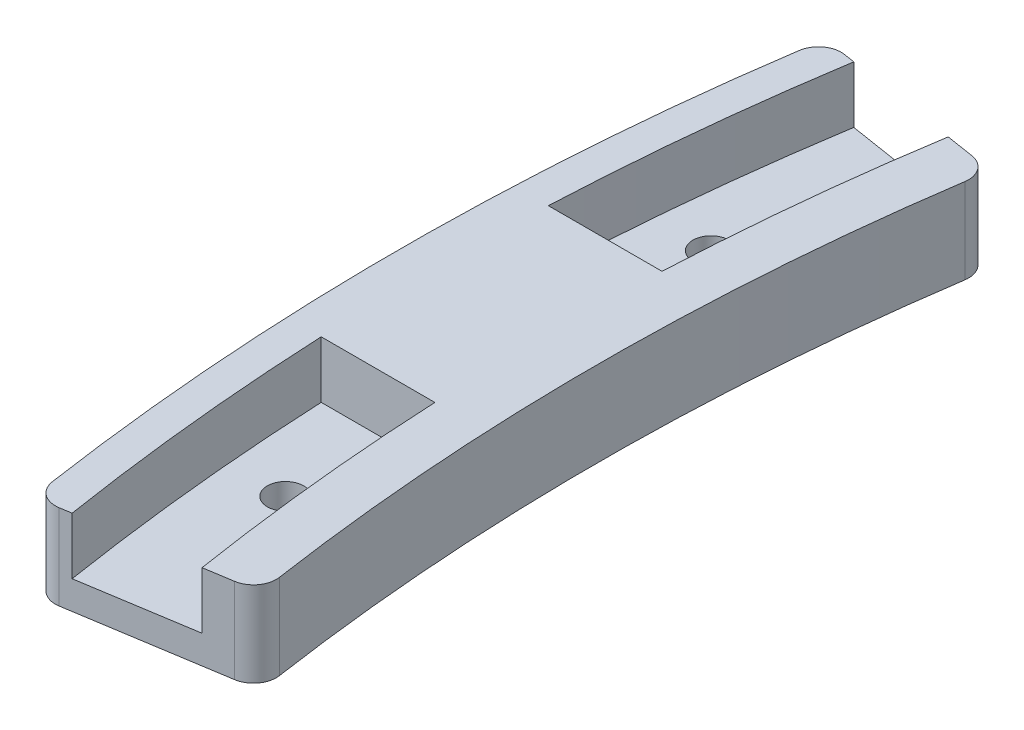
from build123d import *

# Parameters (mm, degrees)
BOSS_EXTRUDE1_DEPTH        = 10
CUT_EXTRUDE1_DEPTH         = 5
F_3_2_3_2_DIAMETER_HOLE1_D = 3.2
FILLET1_R                  = 2
CUT_EXTRUDE2_START         = -2.5
CUT_EXTRUDE2_DEPTH         = 2.5


with BuildPart() as part:
    # Sketch1 → Boss-Extrude1 (new body)
    with BuildSketch(Plane(origin=(0, 0, 0), x_dir=(1, 0, 0), z_dir=(0, 1, 0))):
        with BuildLine():
            ThreePointArc((-207.414551525, 32.851237658), (-210, 0), (-207.414551525, -32.851237658))
            Line((-207.414551525, -32.851237658), (-217.291434931, -34.415582309))
            ThreePointArc((-217.291434931, -34.415582309), (-220, 0), (-217.291434931, 34.415582309))
            Line((-217.291434931, 34.415582309), (-207.414551525, 32.851237658))
        make_face()
        with BuildLine():
            ThreePointArc((-217.291434931, -34.415582309), (-220, 0), (-217.291434931, 34.415582309))
            Line((-217.291434931, 34.415582309), (-220.254499953, 34.884885704))
            ThreePointArc((-220.254499953, 34.884885704), (-223, 0), (-220.254499953, -34.884885704))
            Line((-220.254499953, -34.884885704), (-217.291434931, -34.415582309))
        make_face()
        with BuildLine():
            Line((-202.969953992, 32.147282566), (-207.414551525, 32.851237658))
            ThreePointArc((-207.414551525, 32.851237658), (-210, 0), (-207.414551525, -32.851237658))
            Line((-207.414551525, -32.851237658), (-202.969953992, -32.147282566))
            ThreePointArc((-202.969953992, -32.147282566), (-205.5, 0), (-202.969953992, 32.147282566))
        make_face()
    extrude(amount=BOSS_EXTRUDE1_DEPTH)

    # Sketch15 → Cut-Extrude1 (cut)
    with BuildSketch(Plane(origin=(0, 10, 0), x_dir=(1, 0, 0), z_dir=(0, 1, 0))):
        with BuildLine():
            Line((-219.772609758, 10), (-209.761769634, 10))
            ThreePointArc((-209.761769634, 10), (-208.900850883, 21.457737542), (-207.414551525, 32.851237658))
            Line((-207.414551525, 32.851237658), (-217.291434931, 34.415582309))
            ThreePointArc((-217.291434931, 34.415582309), (-218.872736893, 22.242415451), (-219.772609758, 10))
        make_face()
        with BuildLine():
            ThreePointArc((-207.414551525, -32.851237658), (-208.900850883, -21.457737542), (-209.761769634, -10))
            Line((-209.761769634, -10), (-219.772609758, -10))
            ThreePointArc((-219.772609758, -10), (-218.872736893, -22.242415451), (-217.291434931, -34.415582309))
            Line((-217.291434931, -34.415582309), (-207.414551525, -32.851237658))
        make_face()
    extrude(amount=-CUT_EXTRUDE1_DEPTH, mode=Mode.SUBTRACT)

    # Ø3.2 (3.2) Diameter Hole1 (through all)
    with Locations(Plane(origin=(0, 0, 0), x_dir=(-1, 0, 0), z_dir=(0, -1, 0))):
        with Locations((214.18186009, -18.738484691), (214.18186009, 18.738484691)):
            Hole(F_3_2_3_2_DIAMETER_HOLE1_D / 2)

    # Fillet1
    fillet1_edges = [part.edges().sort_by_distance(p)[0] for p in [
        (-220.254499953, 5, 34.884885704),
        (-220.254499953, 5, -34.884885704),
        (-202.969953992, 5, -32.147282566),
        (-202.969953992, 5, 32.147282566),
    ]]
    fillet(fillet1_edges, radius=FILLET1_R)

    # Sketch19 → Cut-Extrude2 (cut)
    with BuildSketch(Plane.XZ.offset(CUT_EXTRUDE2_START)):
        with BuildLine():
            Line((-218.270184732, -34.570601048), (-204.935810565, -32.458643659))
            ThreePointArc((-204.935810565, -32.458643659), (-203.636329762, -31.666621675), (-203.27037897, -30.189452356))
            ThreePointArc((-203.27037897, -30.189452356), (-205.5, 0), (-203.27037897, 30.189452356))
            ThreePointArc((-203.27037897, 30.189452356), (-203.636329762, 31.666621675), (-204.935810565, 32.458643659))
            Line((-204.935810565, 32.458643659), (-218.270184732, 34.570601048))
            ThreePointArc((-218.270184732, 34.570601048), (-219.765933628, 34.207922413), (-220.561180845, 32.890203773))
            ThreePointArc((-220.561180845, 32.890203773), (-223, 0), (-220.561180845, -32.890203773))
            ThreePointArc((-220.561180845, -32.890203773), (-219.765933628, -34.207922413), (-218.270184732, -34.570601048))
        make_face()
    extrude(amount=CUT_EXTRUDE2_DEPTH, mode=Mode.SUBTRACT)


solid = part.part
